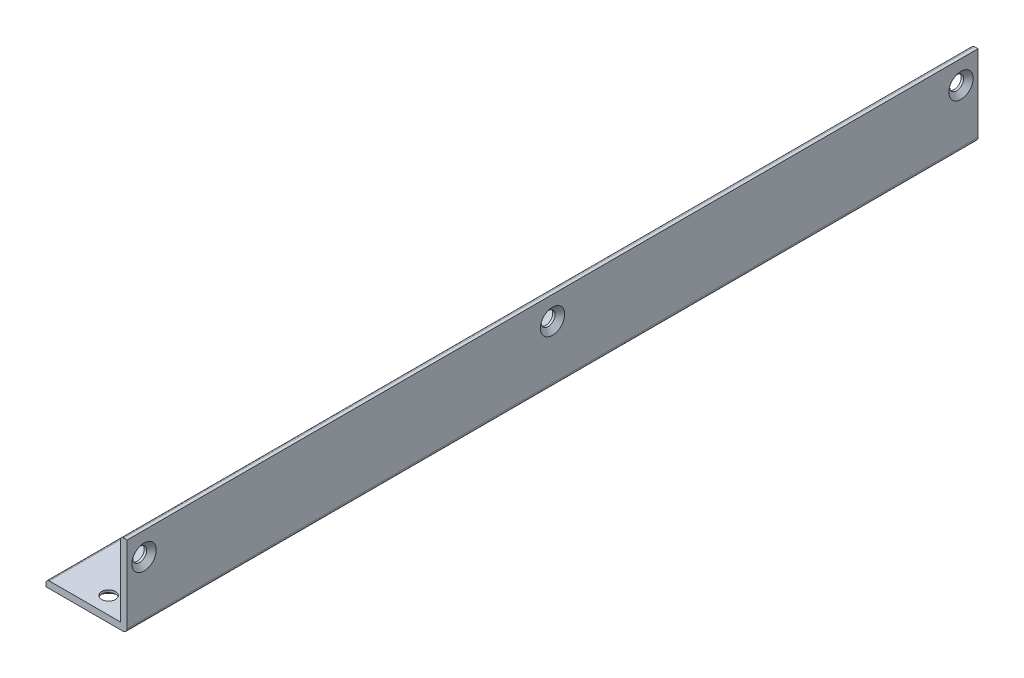
from build123d import *

# Parameters (mm, degrees)
BOSS_EXTRUDE1_DEPTH                               = 100
CSK_FOR_4_FLAT_HEAD_MACHINE_SCREW_100_D           = 3.2639
CSK_FOR_4_FLAT_HEAD_MACHINE_SCREW_100_CSINK_D     = 5.715
CSK_FOR_4_FLAT_HEAD_MACHINE_SCREW_100_CSINK_ANGLE = 100
CSK_FOR_4_FLAT_HEAD_MACHINE_SCREW_2_D             = 3.2639
CSK_FOR_4_FLAT_HEAD_MACHINE_SCREW_2_CSINK_D       = 5.715
CSK_FOR_4_FLAT_HEAD_MACHINE_SCREW_2_CSINK_ANGLE   = 100
FILLET1_R                                         = 1
CSK_FOR_4_FLAT_HEAD_MACHINE_SCREW_3_D             = 3.2639
CSK_FOR_4_FLAT_HEAD_MACHINE_SCREW_3_CSINK_D       = 5.715
CSK_FOR_4_FLAT_HEAD_MACHINE_SCREW_3_CSINK_ANGLE   = 100
CSK_FOR_4_FLAT_HEAD_MACHINE_SCREW_4_D             = 3.2639
CSK_FOR_4_FLAT_HEAD_MACHINE_SCREW_4_CSINK_D       = 5.715
CSK_FOR_4_FLAT_HEAD_MACHINE_SCREW_4_CSINK_ANGLE   = 100
CUT_EXTRUDE1_DEPTH                                = 25


with BuildPart() as part:
    # Sketch2 → Boss-Extrude1 (new, symmetric)
    with BuildSketch(Plane.XY):
        with BuildLine():
            Line((-9.525, 0), (9.525, 0))
            Line((9.525, 0), (9.525, 19.05))
            Line((9.525, 19.05), (8.73125, 19.05))
            ThreePointArc((8.73125, 19.05), (8.169983992, 18.817516008), (7.9375, 18.25625))
            Line((7.9375, 18.25625), (7.9375, 2.38125))
            ThreePointArc((7.9375, 2.38125), (7.705016008, 1.819983992), (7.14375, 1.5875))
            Line((7.14375, 1.5875), (-8.73125, 1.5875))
            ThreePointArc((-8.73125, 1.5875), (-9.292516008, 1.355016008), (-9.525, 0.79375))
            Line((-9.525, 0.79375), (-9.525, 0))
        make_face()
    extrude(amount=BOSS_EXTRUDE1_DEPTH, both=True)

    # CSK for _4 Flat Head Machine Screw _100 (through all)
    with Locations(Plane(origin=(0, 0, 0), x_dir=(-1, 0, 0), z_dir=(0, -1, 0))):
        with Locations((-1.185, -96), (-0.275, 96)):
            CounterSinkHole(CSK_FOR_4_FLAT_HEAD_MACHINE_SCREW_100_D / 2, CSK_FOR_4_FLAT_HEAD_MACHINE_SCREW_100_CSINK_D / 2, counter_sink_angle=CSK_FOR_4_FLAT_HEAD_MACHINE_SCREW_100_CSINK_ANGLE)

    # CSK for _4 Flat Head Machine Screw _ 2 (through all)
    with Locations(Plane(origin=(9.525, 0, 0), x_dir=(0, 0, -1), z_dir=(1, 0, 0))):
        with Locations((-96, 13.5875), (96, 13.5875)):
            CounterSinkHole(CSK_FOR_4_FLAT_HEAD_MACHINE_SCREW_2_D / 2, CSK_FOR_4_FLAT_HEAD_MACHINE_SCREW_2_CSINK_D / 2, counter_sink_angle=CSK_FOR_4_FLAT_HEAD_MACHINE_SCREW_2_CSINK_ANGLE)

    # Fillet1
    fillet1_edges = [part.edges().sort_by_distance(p)[0] for p in [
        (9.525, 0, 0),
    ]]
    fillet(fillet1_edges, radius=FILLET1_R)

    # CSK for _4 Flat Head Machine Screw _ 3 (through all)
    with Locations(Plane(origin=(0, 0, 0), x_dir=(-1, 0, 0), z_dir=(0, -1, 0))):
        with Locations((-0.275, 0)):
            CounterSinkHole(CSK_FOR_4_FLAT_HEAD_MACHINE_SCREW_3_D / 2, CSK_FOR_4_FLAT_HEAD_MACHINE_SCREW_3_CSINK_D / 2, counter_sink_angle=CSK_FOR_4_FLAT_HEAD_MACHINE_SCREW_3_CSINK_ANGLE)

    # CSK for _4 Flat Head Machine Screw _ 4 (through all)
    with Locations(Plane(origin=(9.525, 0, 0), x_dir=(0, 0, -1), z_dir=(1, 0, 0))):
        with Locations((0, 13.5875)):
            CounterSinkHole(CSK_FOR_4_FLAT_HEAD_MACHINE_SCREW_4_D / 2, CSK_FOR_4_FLAT_HEAD_MACHINE_SCREW_4_CSINK_D / 2, counter_sink_angle=CSK_FOR_4_FLAT_HEAD_MACHINE_SCREW_4_CSINK_ANGLE)

    # Sketch26 → Cut-Extrude1 (cut)
    with BuildSketch(Plane.XY.offset(100)):
        Polygon((2.9375, 1.5875), (7.9375, 1.5875), (7.9375, 6.5875), align=None)
    cut_extrude1 = extrude(amount=-CUT_EXTRUDE1_DEPTH, mode=Mode.SUBTRACT)

    # Mirror1: Cut-Extrude1 across plane
    add(cut_extrude1.mirror(Plane.XY), mode=Mode.SUBTRACT)


solid = part.part
